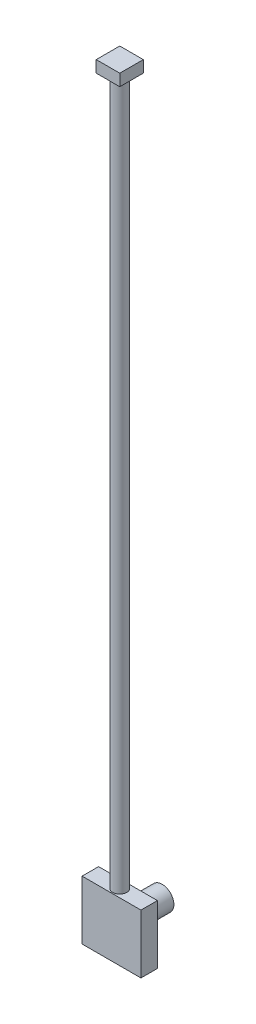
from build123d import *

# Parameters (mm, degrees)
SKETCH_260_W      = 250
SKETCH_260_H      = 250
EXTRUDE_381_DEPTH = 35
EXTRUDE_START     = 125
SKETCH_427_R      = 30
EXTRUDE_458_DEPTH = 3000
SKETCH_521_W      = 100
SKETCH_521_H      = 100
EXTRUDE_612_DEPTH = 50
SKETCH_664_R      = 50
EXTRUDE_692_DEPTH = 180


with BuildPart() as part:
    # Sketch 260 → Extrude 381 (new, symmetric)
    with BuildSketch(Plane.XY):
        Rectangle(SKETCH_260_W, SKETCH_260_H)
    extrude(amount=EXTRUDE_381_DEPTH, both=True)

    # Sketch 427 → Extrude 458 (add)
    with BuildSketch(Plane(origin=(0, 0, 0), x_dir=(1, 0, 0), z_dir=(0, 1, 0)).offset(EXTRUDE_START)):
        Circle(SKETCH_427_R)
    extrude(amount=EXTRUDE_458_DEPTH)

    # Sketch 521 → Extrude 612 (add)
    with BuildSketch(Plane(origin=(0, 3125, 0), x_dir=(1, 0, 0), z_dir=(0, 1, 0))):
        Rectangle(SKETCH_521_W, SKETCH_521_H)
    extrude(amount=EXTRUDE_612_DEPTH)

    # Sketch 664 → Extrude 692 (add)
    with BuildSketch(Plane.XY):
        Circle(SKETCH_664_R)
    extrude(amount=-EXTRUDE_692_DEPTH)


solid = part.part
